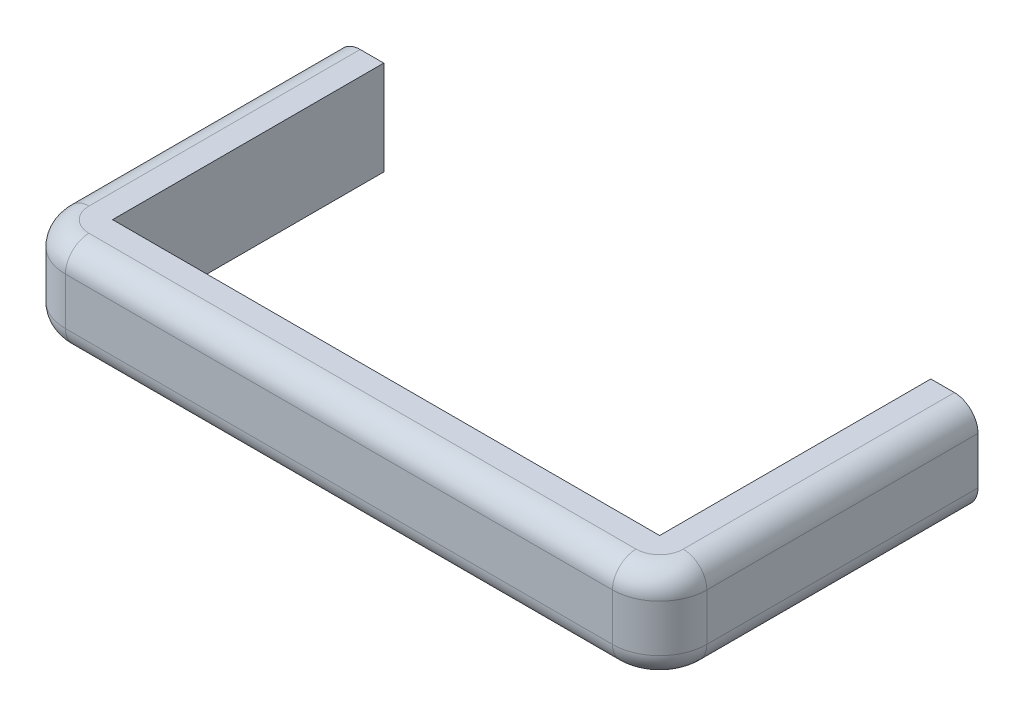
from build123d import *

# Parameters (mm, degrees)
BOSS_EXTRUDE1_DEPTH = 736.6
REVOLVE13_ANGLE     = 90
REVOLVE12_ANGLE     = 90
BOSS_EXTRUDE3_DEPTH = 736.6
REVOLVE2_ANGLE      = 90
BOSS_EXTRUDE4_DEPTH = 736.6
REVOLVE10_ANGLE     = 90
BOSS_EXTRUDE5_DEPTH = 736.6
SKETCH16_W          = 434.975
SKETCH16_H          = 127
CUT_EXTRUDE1_DEPTH  = 1203.851588934


with BuildPart() as part:
    # Sketch1 → Boss-Extrude1 (new body)
    with BuildSketch(Plane(origin=(0, 0, 0), x_dir=(0, 0, -1), z_dir=(1, 0, 0))):
        with BuildLine():
            ThreePointArc((0, 31.75), (-22.450640303, 22.450640303), (-31.75, 0))
            Line((-31.75, 0), (-31.75, -63.5))
            ThreePointArc((-31.75, -63.5), (-22.450640303, -85.950640303), (0, -95.25))
            Line((0, -95.25), (31.75, -95.25))
            Line((31.75, -95.25), (31.75, 0))
            Line((31.75, 0), (31.75, 31.75))
            Line((31.75, 31.75), (0, 31.75))
        make_face()
    extrude(amount=BOSS_EXTRUDE1_DEPTH)



with BuildPart() as body_2:
    # Sketch8 → Revolve13 (revolve)
    with BuildSketch(Plane(origin=(736.6, 0, 0), x_dir=(0, 0, -1), z_dir=(1, 0, 0))):
        with BuildLine():
            Line((-31.75, 0), (-31.75, -63.5))
            ThreePointArc((-31.75, -63.5), (-22.450640303, -85.950640303), (0, -95.25))
            Line((0, -95.25), (31.75, -95.25))
            Line((31.75, -95.25), (31.75, 31.75))
            Line((31.75, 31.75), (0, 31.75))
            ThreePointArc((0, 31.75), (-22.450640303, 22.450640303), (-31.75, 0))
        make_face()
    revolve(axis=Axis((736.6, -95.25, -31.75), (0, 1, 0)), revolution_arc=REVOLVE13_ANGLE)


with BuildPart() as body_3:
    # Sketch15 → Revolve12 (revolve)
    with BuildSketch(Plane(origin=(0, 0, -31.75), x_dir=(0, 0, 1), z_dir=(-1, 0, 0))):
        with BuildLine():
            ThreePointArc((31.75, -95.25), (54.200640303, -85.950640303), (63.5, -63.5))
            Line((63.5, -63.5), (63.5, 0))
            ThreePointArc((63.5, 0), (54.200640303, 22.450640303), (31.75, 31.75))
            Line((31.75, 31.75), (0, 31.75))
            Line((0, 31.75), (0, -95.25))
            Line((0, -95.25), (31.75, -95.25))
        make_face()
    revolve(axis=Axis((0, 31.75, -31.75), (0, -1, 0)), revolution_arc=REVOLVE12_ANGLE)


with BuildPart() as part_1:
    add(part.part)

    add(body_2.part)  # Boss-Extrude3 merges body 2
    # Sketch7 → Boss-Extrude3 (add)
    with BuildSketch(Plane(origin=(0, 0, -31.75), x_dir=(-1, 0, 0), z_dir=(0, 0, -1))):
        with BuildLine():
            ThreePointArc((-768.35, 31.75), (-790.800640303, 22.450640303), (-800.1, 0))
            Line((-800.1, 0), (-800.1, -63.5))
            ThreePointArc((-800.1, -63.5), (-790.800640303, -85.950640303), (-768.35, -95.25))
            Line((-768.35, -95.25), (-736.6, -95.25))
            Line((-736.6, -95.25), (-736.6, 31.75))
            Line((-736.6, 31.75), (-768.35, 31.75))
        make_face()
    extrude(amount=BOSS_EXTRUDE3_DEPTH)

    # Sketch12 → Revolve2 (revolve)
    with BuildSketch(Plane(origin=(1454.15, 0, -768.35), x_dir=(-1, 0, 0), z_dir=(0, 0, -1))):
        with BuildLine():
            ThreePointArc((685.8, 31.75), (663.349359697, 22.450640303), (654.05, 0))
            Line((654.05, 0), (654.05, -63.5))
            ThreePointArc((654.05, -63.5), (663.349359697, -85.950640303), (685.8, -95.25))
            Line((685.8, -95.25), (717.55, -95.25))
            Line((717.55, -95.25), (717.55, 31.75))
            Line((717.55, 31.75), (685.8, 31.75))
        make_face()
    revolve(axis=Axis((736.6, -95.25, -768.35), (0, 1, 0)), revolution_arc=REVOLVE2_ANGLE)


    add(body_3.part)  # Boss-Extrude4 merges body 3
    # Sketch9 → Boss-Extrude4 (add)
    with BuildSketch(Plane(origin=(0, 0, -31.75), x_dir=(-1, 0, 0), z_dir=(0, 0, -1))):
        with BuildLine():
            Line((0, 31.75), (0, -95.25))
            Line((0, -95.25), (31.75, -95.25))
            ThreePointArc((31.75, -95.25), (54.200640303, -85.950640303), (63.5, -63.5))
            Line((63.5, -63.5), (63.5, 0))
            ThreePointArc((63.5, 0), (54.200640303, 22.450640303), (31.75, 31.75))
            Line((31.75, 31.75), (0, 31.75))
        make_face()
    extrude(amount=BOSS_EXTRUDE4_DEPTH)


with BuildPart() as body_2_2:
    # Sketch14 → Revolve10 (revolve)
    with BuildSketch(Plane(origin=(0, 0, -768.35), x_dir=(-1, 0, 0), z_dir=(0, 0, -1))):
        with BuildLine():
            Line((31.75, 31.75), (0, 31.75))
            Line((0, 31.75), (0, -95.25))
            Line((0, -95.25), (31.75, -95.25))
            ThreePointArc((31.75, -95.25), (54.200640303, -85.950640303), (63.5, -63.5))
            Line((63.5, -63.5), (63.5, 0))
            ThreePointArc((63.5, 0), (54.200640303, 22.450640303), (31.75, 31.75))
        make_face()
    revolve(axis=Axis((0, 31.75, -768.35), (0, -1, 0)), revolution_arc=REVOLVE10_ANGLE)


with BuildPart() as body_3_2:
    # Sketch10 → Boss-Extrude5 (new body)
    with BuildSketch(Plane(origin=(0, 0, 0), x_dir=(0, 0, -1), z_dir=(1, 0, 0))):
        with BuildLine():
            ThreePointArc((831.85, 0), (822.550640303, 22.450640303), (800.1, 31.75))
            Line((800.1, 31.75), (768.35, 31.75))
            Line((768.35, 31.75), (768.35, -95.25))
            Line((768.35, -95.25), (800.1, -95.25))
            ThreePointArc((800.1, -95.25), (822.550640303, -85.950640303), (831.85, -63.5))
            Line((831.85, -63.5), (831.85, 0))
        make_face()
    extrude(amount=BOSS_EXTRUDE5_DEPTH)


with BuildPart() as part_2:
    add(part_1.part)

    # Combine1: union body 3 2, body 2 2
    add(body_3_2.part)
    add(body_2_2.part)

    # Sketch16 → Cut-Extrude1 (cut, through all)
    with BuildSketch(Plane(origin=(800.1, 0, 0), x_dir=(0, 0, -1), z_dir=(1, 0, 0))):
        with Locations((614.3625, -31.75)):
            Rectangle(SKETCH16_W, SKETCH16_H)
    extrude(amount=-CUT_EXTRUDE1_DEPTH, mode=Mode.SUBTRACT)


solid = part_2.part
